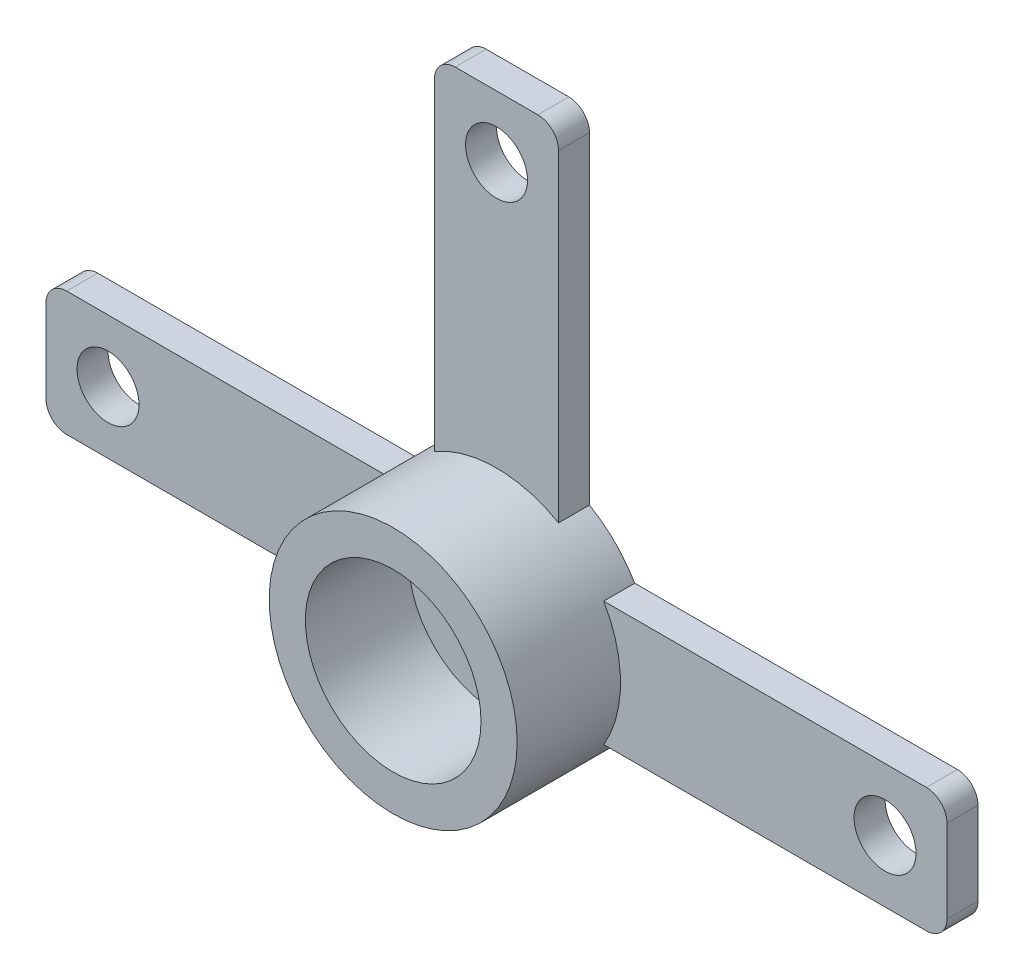
from build123d import *

# Parameters (mm, degrees)
SKETCH_2_R      = 2.66
SKETCH_2_R_2    = 1.5
EXTRUDE_1_DEPTH = 1.5
SKETCH_3_R      = 6
SKETCH_3_R_2    = 4.25
EXTRUDE_2_DEPTH = 5


with BuildPart() as part:
    # 草图2 → 凸台-拉伸1 (new body)
    with BuildSketch(Plane.XY):
        with BuildLine():
            Line((-5.188427748, -15.986660076), (-20.8, -15.986660076))
            ThreePointArc((-20.8, -15.986660076), (-21.507106781, -16.279553295), (-21.8, -16.986660076))
            Line((-21.8, -16.986660076), (-21.8, -21))
            ThreePointArc((-21.8, -21), (-21.507106781, -21.707106781), (-20.8, -22))
            Line((-20.8, -22), (-5.196152423, -22))
            ThreePointArc((-5.196152423, -22), (0, -25), (5.196152423, -22))
            Line((5.196152423, -22), (20.8, -22))
            ThreePointArc((20.8, -22), (21.507106781, -21.707106781), (21.8, -21))
            Line((21.8, -21), (21.8, -16.986660076))
            ThreePointArc((21.8, -16.986660076), (21.507106781, -16.279553295), (20.8, -15.986660076))
            Line((20.8, -15.986660076), (5.188427748, -15.986660076))
            ThreePointArc((5.188427748, -15.986660076), (4.237187139, -14.751912766), (3, -13.803847577))
            Line((3, -13.803847577), (3, 1.8))
            ThreePointArc((3, 1.8), (2.707106781, 2.507106781), (2, 2.8))
            Line((2, 2.8), (-2, 2.8))
            ThreePointArc((-2, 2.8), (-2.707106781, 2.507106781), (-3, 1.8))
            Line((-3, 1.8), (-3, -13.803847577))
            ThreePointArc((-3, -13.803847577), (-4.237187139, -14.751912766), (-5.188427748, -15.986660076))
        make_face()
        with Locations((0, -19)):
            Circle(SKETCH_2_R, mode=Mode.SUBTRACT)
        with Locations((-18.8, -19)):
            Circle(SKETCH_2_R_2, mode=Mode.SUBTRACT)
        with Locations((18.8, -19)):
            Circle(SKETCH_2_R_2, mode=Mode.SUBTRACT)
        with Locations((0, -0.2)):
            Circle(SKETCH_2_R_2, mode=Mode.SUBTRACT)
    extrude(amount=EXTRUDE_1_DEPTH)

    # 草图3 → 凸台-拉伸2 (add)
    with BuildSketch(Plane.XY.offset(1.5)):
        with Locations(Location((0, -19, 0), (0, 0, 210))):
            Circle(SKETCH_3_R)
        with Locations((0, -19)):
            Circle(SKETCH_3_R_2, mode=Mode.SUBTRACT)
    extrude(amount=EXTRUDE_2_DEPTH)


solid = part.part
